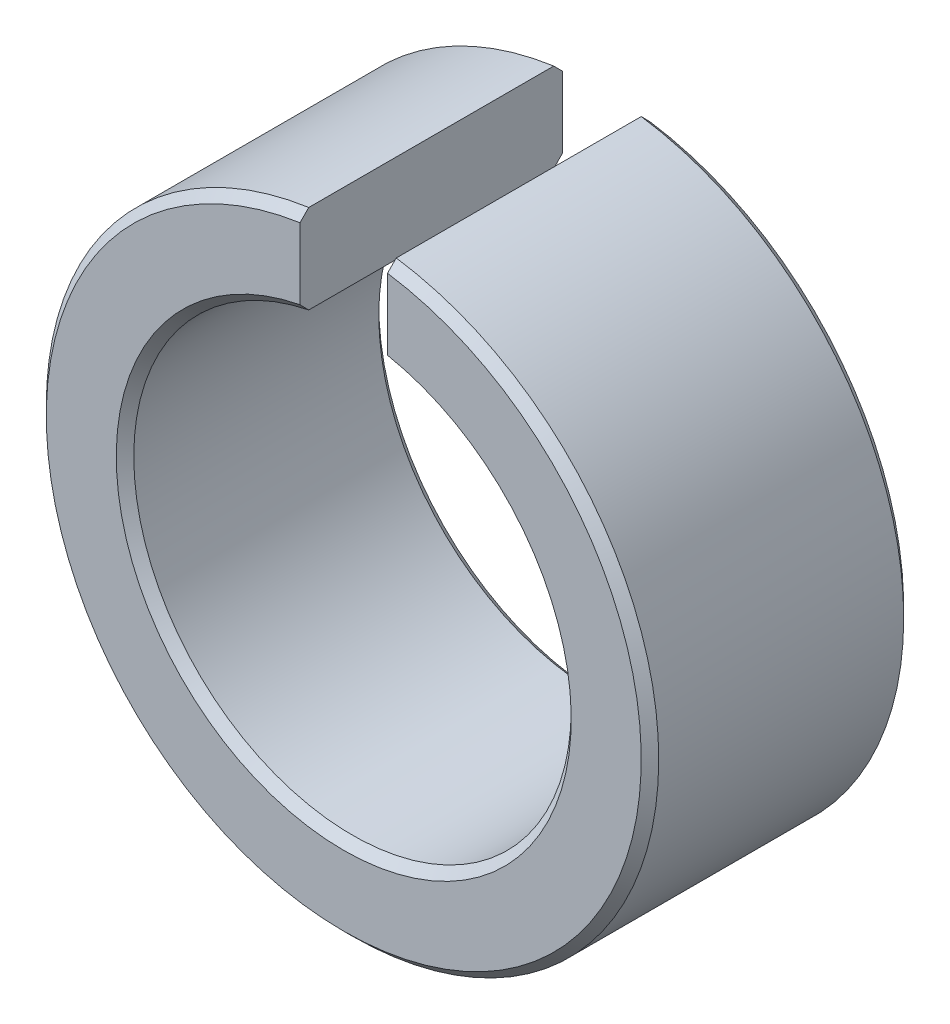
from build123d import *

# Parameters (mm, degrees)
SKETCH_1_R               = 3.5
SKETCH_1_R_2             = 2.5
EXTRUDE_1_DEPTH          = 3
CHAMFER_1_SIZE           = 0.1
CUT_EXTRUDE_2_DEPTH      = 6.787918451
CUT_EXTRUDE_2_DEPTH_BACK = 6.787918451
SKETCH_2_W               = 1
SKETCH_2_H               = 3.5


with BuildPart() as part:
    # 草图1 → 拉伸-薄壁1 (new body)
    with BuildSketch(Plane.XY):
        Circle(SKETCH_1_R)
        Circle(SKETCH_1_R_2, mode=Mode.SUBTRACT)
    extrude(amount=EXTRUDE_1_DEPTH)

    # 倒角1
    chamfer_1_edges = [part.edges().sort_by_distance(p)[0] for p in [
        (-3.5, 0, 0),
        (-2.5, 0, 0),
        (-3.5, 0, 3),
        (-2.5, 0, 3),
    ]]
    chamfer(chamfer_1_edges, length=CHAMFER_1_SIZE)

    # 草图2 → 切除-拉伸-薄壁2 (cut, two sides: drawn at the far end of the back side and taken through both)
    with BuildSketch(Plane(origin=(0, 0, 0), x_dir=(-1, 0, 0), z_dir=(0, 0, -1)).offset(-CUT_EXTRUDE_2_DEPTH_BACK)):
        with Locations((0, 1.75)):
            Rectangle(SKETCH_2_W, SKETCH_2_H)
    extrude(amount=CUT_EXTRUDE_2_DEPTH + CUT_EXTRUDE_2_DEPTH_BACK, mode=Mode.SUBTRACT)


solid = part.part
